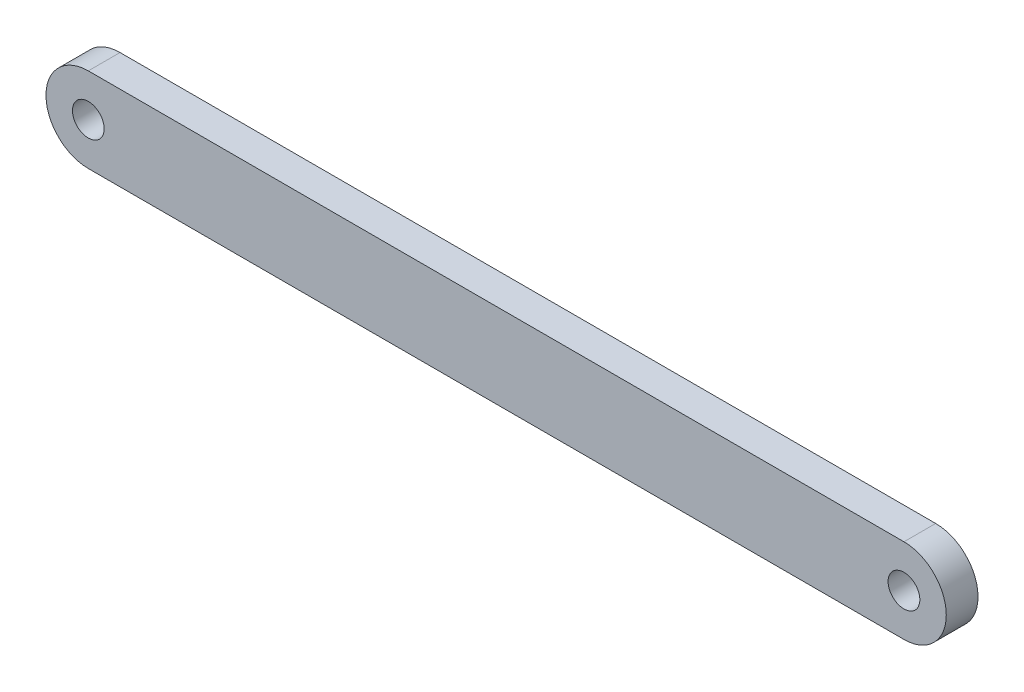
from build123d import *

# Parameters (mm, degrees)
SKETCH1_R           = 2.38125
BOSS_EXTRUDE1_DEPTH = 4.7625


with BuildPart() as part:
    # Sketch1 → Boss-Extrude1 (new body)
    with BuildSketch(Plane.XY):
        with BuildLine():
            Line((0, 6.35), (122.428, 6.35))
            ThreePointArc((122.428, 6.35), (128.778, 0), (122.428, -6.35))
            Line((122.428, -6.35), (0, -6.35))
            ThreePointArc((0, -6.35), (-6.35, 0), (0, 6.35))
        make_face()
        with Locations(Location((0, 0, 0), (0, 0, 180))):
            Circle(SKETCH1_R, mode=Mode.SUBTRACT)
        with Locations(Location((122.428, 0, 0), (0, 0, 180))):
            Circle(SKETCH1_R, mode=Mode.SUBTRACT)
    extrude(amount=BOSS_EXTRUDE1_DEPTH)


solid = part.part
